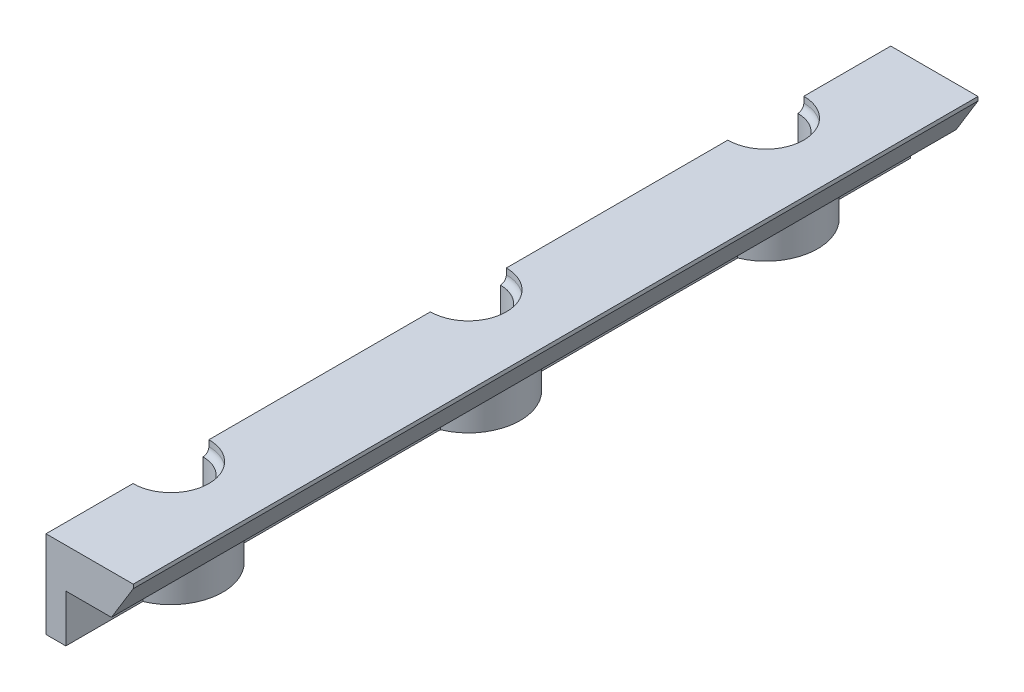
from build123d import *
from OCP.BRepFilletAPI import BRepFilletAPI_MakeChamfer

# Parameters (mm, degrees)
BOSS_EXTRUDE1_DEPTH     = 10
BOSS_EXTRUDE2_DEPTH     = 12
CUT_EXTRUDE3_DEPTH      = 6
CUT_EXTRUDE3_DEPTH_BACK = 14
SKETCH7_R               = 1.95
SKETCH8_R               = 1.95
CUT_EXTRUDE4_DEPTH      = 4
SKETCH9_R               = 1.5
CUT_EXTRUDE5_DEPTH      = 4
LPATTERN1_COUNT         = 2
LPATTERN1_PITCH         = 75
CHAMFER2_SIZE           = 5.5
CHAMFER2_SIZE2          = 9
CHAMFER3_SIZE           = 7
CHAMFER3_SIZE2          = 2
LPATTERN2_COUNT         = 3
LPATTERN2_PITCH         = 75


with BuildPart() as part:
    # Sketch1 → Boss-Extrude1 (new body)
    with BuildSketch(Plane(origin=(0, 0, 0), x_dir=(1, 0, 0), z_dir=(0, 1, 0))):
        with BuildLine():
            Line((0, -8.075), (0, -31.5))
            Line((0, -31.5), (22, -31.5))
            Line((22, -31.5), (22, 181.5))
            Line((22, 181.5), (0, 181.5))
            Line((0, 181.5), (0, 158.075))
            ThreePointArc((0, 158.075), (8.075, 150), (0, 141.925))
            Line((0, 141.925), (0, 83.075))
            ThreePointArc((0, 83.075), (8.075, 75), (0, 66.925))
            Line((0, 66.925), (0, 8.075))
            ThreePointArc((0, 8.075), (8.075, 0), (0, -8.075))
        make_face()
    extrude(amount=-BOSS_EXTRUDE1_DEPTH)

    # Sketch3 → Boss-Extrude2 (add)
    with BuildSketch(Plane.XZ.offset(10)):
        with BuildLine():
            Line((0, -181.5), (0, -158.075))
            ThreePointArc((0, -158.075), (8.075, -150), (0, -141.925))
            Line((0, -141.925), (0, -83.075))
            ThreePointArc((0, -83.075), (8.075, -75), (0, -66.925))
            Line((0, -66.925), (0, -8.075))
            ThreePointArc((0, -8.075), (8.075, 0), (0, 8.075))
            Line((0, 8.075), (0, 31.5))
            Line((0, 31.5), (5, 31.5))
            Line((5, 31.5), (5, 12.081209583))
            ThreePointArc((5, 12.081209583), (13.075, 0), (5, -12.081209583))
            Line((5, -12.081209583), (5, -62.918790417))
            ThreePointArc((5, -62.918790417), (13.075, -75), (5, -87.081209583))
            Line((5, -87.081209583), (5, -137.918790417))
            ThreePointArc((5, -137.918790417), (13.075, -150), (5, -162.081209583))
            Line((5, -162.081209583), (5, -181.5))
            Line((5, -181.5), (0, -181.5))
        make_face()
    extrude(amount=BOSS_EXTRUDE2_DEPTH)

    # Sketch7 → Cut-Extrude3 (cut, two sides: drawn at the far end of the back side and taken through both)
    with BuildSketch(Plane.ZY.offset(-CUT_EXTRUDE3_DEPTH_BACK)):
        with Locations((-170.5, -4)):
            Circle(SKETCH7_R)
        with Locations((-170.5, -18)):
            Circle(SKETCH7_R)
        with Locations(Location((-129.5, -4, 0), (0, 0, 180))):
            Circle(SKETCH7_R)
        with Locations((-129.5, -18)):
            Circle(SKETCH7_R)
        with Locations((-95.5, -4)):
            Circle(SKETCH7_R)
        with Locations(Location((-54.5, -4, 0), (0, 0, 180))):
            Circle(SKETCH7_R)
        with Locations((-54.5, -18)):
            Circle(SKETCH7_R)
        with Locations((-95.5, -18)):
            Circle(SKETCH7_R)
        with Locations((-20.5, -4)):
            Circle(SKETCH7_R)
        with Locations(Location((20.5, -4, 0), (0, 0, 180))):
            Circle(SKETCH7_R)
        with Locations((20.5, -18)):
            Circle(SKETCH7_R)
        with Locations((-20.5, -18)):
            Circle(SKETCH7_R)
    extrude(amount=CUT_EXTRUDE3_DEPTH + CUT_EXTRUDE3_DEPTH_BACK, mode=Mode.SUBTRACT)

    # Sketch8 → Cut-Extrude4 (cut)
    with BuildSketch(Plane.ZY):
        with Locations((-112.5, -18.5)):
            Circle(SKETCH8_R)
    cut_extrude4 = extrude(amount=-CUT_EXTRUDE4_DEPTH, mode=Mode.SUBTRACT)

    # Sketch9 → Cut-Extrude5 (cut)
    with BuildSketch(Plane.ZY.offset(-4)):
        with Locations((-112.5, -18.5)):
            Circle(SKETCH9_R)
    cut_extrude5 = extrude(amount=-CUT_EXTRUDE5_DEPTH, mode=Mode.SUBTRACT)

    # LPattern1: Cut-Extrude4, Cut-Extrude5 ×2
    with Locations(*[(0, 0, i * LPATTERN1_PITCH) for i in range(1, LPATTERN1_COUNT)]):
        add(cut_extrude4, mode=Mode.SUBTRACT)
        add(cut_extrude5, mode=Mode.SUBTRACT)

    # Chamfer2
    chamfer2_edges = [part.edges().sort_by_distance(p)[0] for p in [
        (22, -10, -75),
    ]]
    chamfer2_side = [part.faces().sort_by_distance(p)[0] for p in [
        (14.183508734, -10, -75),
    ]]
    chamfer(chamfer2_edges, length=CHAMFER2_SIZE, length2=CHAMFER2_SIZE2, reference=chamfer2_side[0])

    # Chamfer3: one chamfer whose edges measure the first distance from different faces: ONE call of the kernel's chamfer builder (chamfer() names one face for all edges)
    chamfer3_edges_1 = [part.edges().sort_by_distance(p)[0] for p in [
        (8.075, -22, 0),
    ]]
    chamfer3_side_1 = [part.faces().sort_by_distance(p)[0] for p in [
        (8.075, -11, 0),
    ]]
    chamfer3_edges_2 = [part.edges().sort_by_distance(p)[0] for p in [
        (8.075, -22, -75),
    ]]
    chamfer3_side_2 = [part.faces().sort_by_distance(p)[0] for p in [
        (8.075, -11, -75),
    ]]
    chamfer3_edges_3 = [part.edges().sort_by_distance(p)[0] for p in [
        (8.075, -22, -150),
    ]]
    chamfer3_side_3 = [part.faces().sort_by_distance(p)[0] for p in [
        (8.075, -11, -150),
    ]]
    chamfer3 = BRepFilletAPI_MakeChamfer(part.part.solid().wrapped)
    for e in chamfer3_edges_1:
        chamfer3.Add(CHAMFER3_SIZE, CHAMFER3_SIZE2, e.wrapped, chamfer3_side_1[0].wrapped)  # the first distance lies on this face
    for e in chamfer3_edges_2:
        chamfer3.Add(CHAMFER3_SIZE, CHAMFER3_SIZE2, e.wrapped, chamfer3_side_2[0].wrapped)  # the first distance lies on this face
    for e in chamfer3_edges_3:
        chamfer3.Add(CHAMFER3_SIZE, CHAMFER3_SIZE2, e.wrapped, chamfer3_side_3[0].wrapped)  # the first distance lies on this face
    add(Compound.cast(chamfer3.Shape()), mode=Mode.REPLACE)

    # Sketch10 → Cut-Revolve1 (revolve, cut)
    with BuildSketch(Plane.ZY):
        with BuildLine():
            Line((-159.575, 1.581763394), (-159.575, -1.5))
            ThreePointArc((-159.575, -1.5), (-157.014339828, -2.560660172), (-158.075, 0))
            Line((-158.075, 0), (-159.575, 1.581763394))
        make_face()
    cut_revolve1 = revolve(axis=Axis((0, 2.197765982, -150), (0, -1, 0)), mode=Mode.SUBTRACT)

    # LPattern2: Cut-Revolve1 ×3
    with Locations(*[(0, 0, i * LPATTERN2_PITCH) for i in range(1, LPATTERN2_COUNT)]):
        add(cut_revolve1, mode=Mode.SUBTRACT)


solid = part.part
